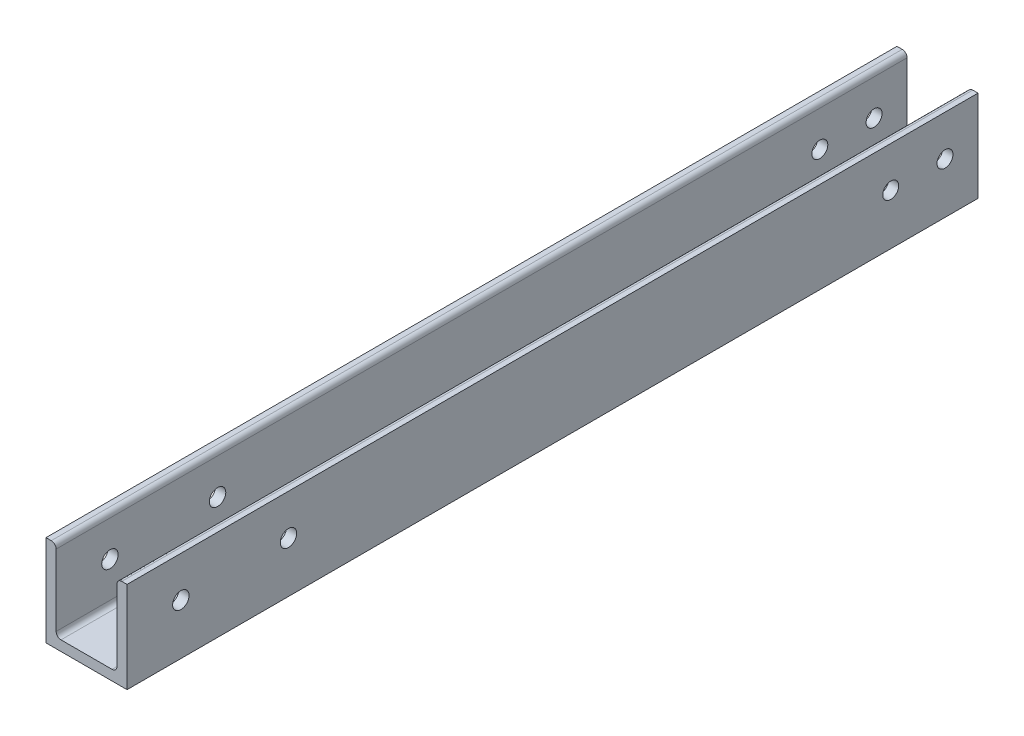
from build123d import *

# Parameters (mm, degrees)
BOSS_EXTRUDE1_DEPTH = 266.7
SKETCH7_R           = 2.575
CUT_EXTRUDE5_DEPTH  = 270.426391849
SKETCH8_R           = 2.5
CUT_EXTRUDE7_DEPTH  = 270.426391849


with BuildPart() as part:
    # Sketch1 → Boss-Extrude1 (new body)
    with BuildSketch(Plane.XY):
        with BuildLine():
            Line((-12.7, 0), (12.7, 0))
            Line((12.7, 0), (12.7, 6.35))
            Line((12.7, 6.35), (12.7, 28.575))
            Line((12.7, 28.575), (11.049, 28.575))
            ThreePointArc((11.049, 28.575), (9.971369265, 28.128630735), (9.525, 27.051))
            Line((9.525, 27.051), (9.525, 4.699))
            ThreePointArc((9.525, 4.699), (9.078630735, 3.621369265), (8.001, 3.175))
            Line((8.001, 3.175), (-8.001, 3.175))
            ThreePointArc((-8.001, 3.175), (-9.078630735, 3.621369265), (-9.525, 4.699))
            Line((-9.525, 4.699), (-9.525, 27.051))
            ThreePointArc((-9.525, 27.051), (-9.971369265, 28.128630735), (-11.049, 28.575))
            Line((-11.049, 28.575), (-12.7, 28.575))
            Line((-12.7, 28.575), (-12.7, 3.175))
            Line((-12.7, 3.175), (-12.7, 0))
        make_face()
    extrude(amount=BOSS_EXTRUDE1_DEPTH)

    # Sketch7 → Cut-Extrude5 (cut, through all)
    with BuildSketch(Plane(origin=(12.7, 0, 0), x_dir=(0, 0, -1), z_dir=(1, 0, 0))):
        with Locations(Location((-216.108705962, 15.875, 0), (0, 0, 90))):
            Circle(SKETCH7_R)
        with Locations(Location((-249.836235321, 15.875, 0), (0, 0, 90))):
            Circle(SKETCH7_R)
    extrude(amount=-CUT_EXTRUDE5_DEPTH, mode=Mode.SUBTRACT)

    # Sketch8 → Cut-Extrude7 (cut, through all)
    with BuildSketch(Plane.ZY.offset(12.7)):
        with Locations((10.35, 15.875)):
            Circle(SKETCH8_R)
        with Locations((27.35, 15.875)):
            Circle(SKETCH8_R)
    extrude(amount=-CUT_EXTRUDE7_DEPTH, mode=Mode.SUBTRACT)


solid = part.part
